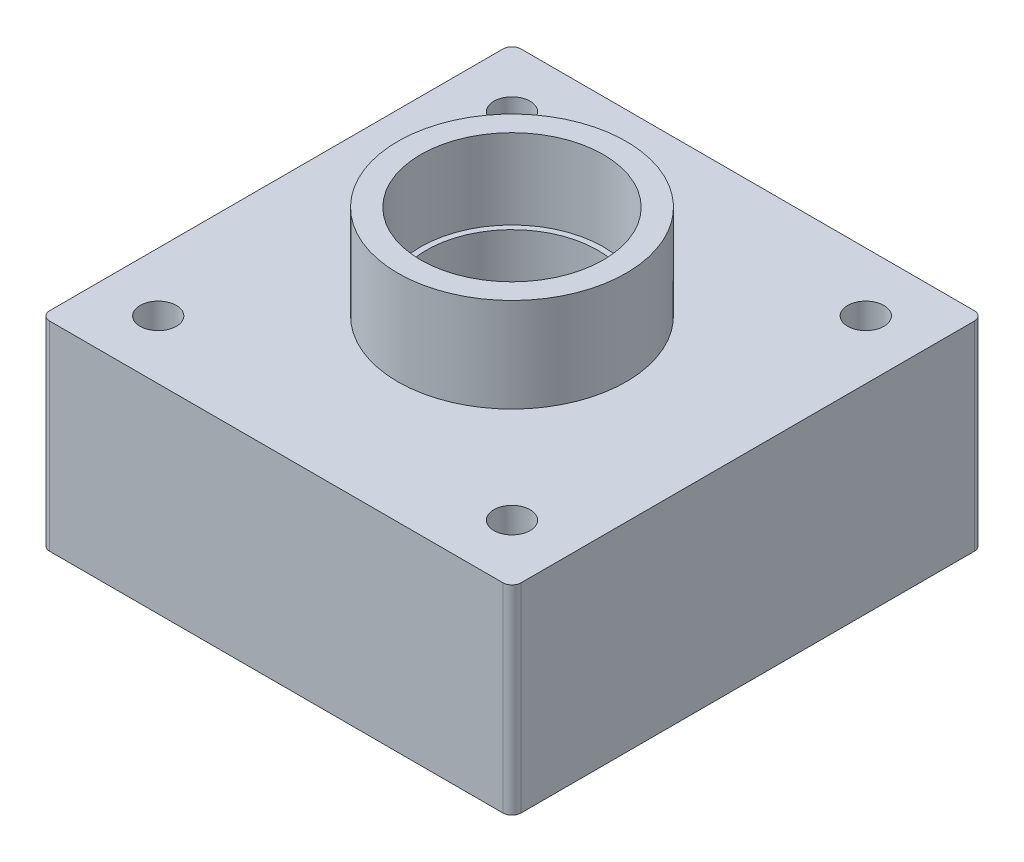
from build123d import *

# Parameters (mm, degrees)
SKETCH1_R                        = 6.35
BOSS_EXTRUDE1_DEPTH              = 69.85
SKETCH1_3_R                      = 20
CUT_EXTRUDE1_DEPTH               = 40
SKETCH1_4_R                      = 76.2
SKETCH1_4_R_2                    = 69.85
CUT_EXTRUDE2_DEPTH               = 8
SKETCH2_R                        = 40
BOSS_EXTRUDE2_DEPTH              = 32.95
SKETCH3_R                        = 32
CUT_EXTRUDE5_DEPTH               = 28
SKETCH4_R                        = 30
CUT_EXTRUDE6_DEPTH               = 22
F_1_2_14_NPSM_TAPPED_HOLE2_D     = 18.9738
F_1_2_14_NPSM_TAPPED_HOLE2_DEPTH = 41.91
CUT_EXTRUDE7_REACH               = 157.553
SKETCH12_R                       = 6.35


with BuildPart() as part:
    # Sketch1 → Boss-Extrude1 (new body)
    with BuildSketch(Plane(origin=(0, 0, 0), x_dir=(1, 0, 0), z_dir=(0, 1, 0))):
        with BuildLine():
            ThreePointArc((-82.55, -79.375), (-81.62006403, -81.62006403), (-79.375, -82.55))
            Line((-79.375, -82.55), (79.375, -82.55))
            ThreePointArc((79.375, -82.55), (81.62006403, -81.62006403), (82.55, -79.375))
            Line((82.55, -79.375), (82.55, 79.375))
            ThreePointArc((82.55, 79.375), (81.62006403, 81.62006403), (79.375, 82.55))
            Line((79.375, 82.55), (-79.375, 82.55))
            ThreePointArc((-79.375, 82.55), (-81.62006403, 81.62006403), (-82.55, 79.375))
            Line((-82.55, 79.375), (-82.55, -79.375))
        make_face()
        with Locations((-61.963767235, -61.963767235)):
            Circle(SKETCH1_R, mode=Mode.SUBTRACT)
        with Locations((61.963767235, -61.963767235)):
            Circle(SKETCH1_R, mode=Mode.SUBTRACT)
        with Locations((-61.963767235, 61.963767235)):
            Circle(SKETCH1_R, mode=Mode.SUBTRACT)
        with Locations((61.963767235, 61.963767235)):
            Circle(SKETCH1_R, mode=Mode.SUBTRACT)
    extrude(amount=BOSS_EXTRUDE1_DEPTH)

    # Sketch1<3> → Cut-Extrude1 (cut)
    with BuildSketch(Plane(origin=(0, 0, 0), x_dir=(1, 0, 0), z_dir=(0, 1, 0))):
        Circle(SKETCH1_3_R)
    extrude(amount=CUT_EXTRUDE1_DEPTH, mode=Mode.SUBTRACT)

    # Sketch1<4> → Cut-Extrude2 (cut)
    with BuildSketch(Plane(origin=(0, 0, 0), x_dir=(1, 0, 0), z_dir=(0, 1, 0))):
        Circle(SKETCH1_4_R)
        Circle(SKETCH1_4_R_2, mode=Mode.SUBTRACT)
    extrude(amount=CUT_EXTRUDE2_DEPTH, mode=Mode.SUBTRACT)

    # Sketch2 → Boss-Extrude2 (add)
    with BuildSketch(Plane(origin=(0, 69.85, 0), x_dir=(1, 0, 0), z_dir=(0, 1, 0))):
        Circle(SKETCH2_R)
    extrude(amount=BOSS_EXTRUDE2_DEPTH)

    # Sketch3 → Cut-Extrude5 (cut)
    with BuildSketch(Plane(origin=(0, 102.8, 0), x_dir=(1, 0, 0), z_dir=(0, 1, 0))):
        Circle(SKETCH3_R)
    extrude(amount=-CUT_EXTRUDE5_DEPTH, mode=Mode.SUBTRACT)

    # Sketch4 → Cut-Extrude6 (cut)
    with BuildSketch(Plane(origin=(0, 74.8, 0), x_dir=(1, 0, 0), z_dir=(0, 1, 0))):
        Circle(SKETCH4_R)
    extrude(amount=-CUT_EXTRUDE6_DEPTH, mode=Mode.SUBTRACT)

    # 1/2-14 NPSM Tapped Hole2
    with Locations(Plane.ZY.offset(82.55)):
        with Locations((0, 25.4)):
            Hole(F_1_2_14_NPSM_TAPPED_HOLE2_D / 2, depth=F_1_2_14_NPSM_TAPPED_HOLE2_DEPTH)

    # Sketch12 → Cut-Extrude7 (cut, up to next)
    with BuildSketch(Plane.XZ, mode=Mode.PRIVATE) as cut_extrude7_sk1:
        with Locations((-50.55, 0)):
            Circle(SKETCH12_R)
    cut_extrude7_tool1 = extrude(cut_extrude7_sk1.sketch, amount=-CUT_EXTRUDE7_REACH, mode=Mode.PRIVATE) & part.part
    add(cut_extrude7_tool1.solids().sort_by_distance((-50.55, 0, 0))[0], mode=Mode.SUBTRACT)


solid = part.part
